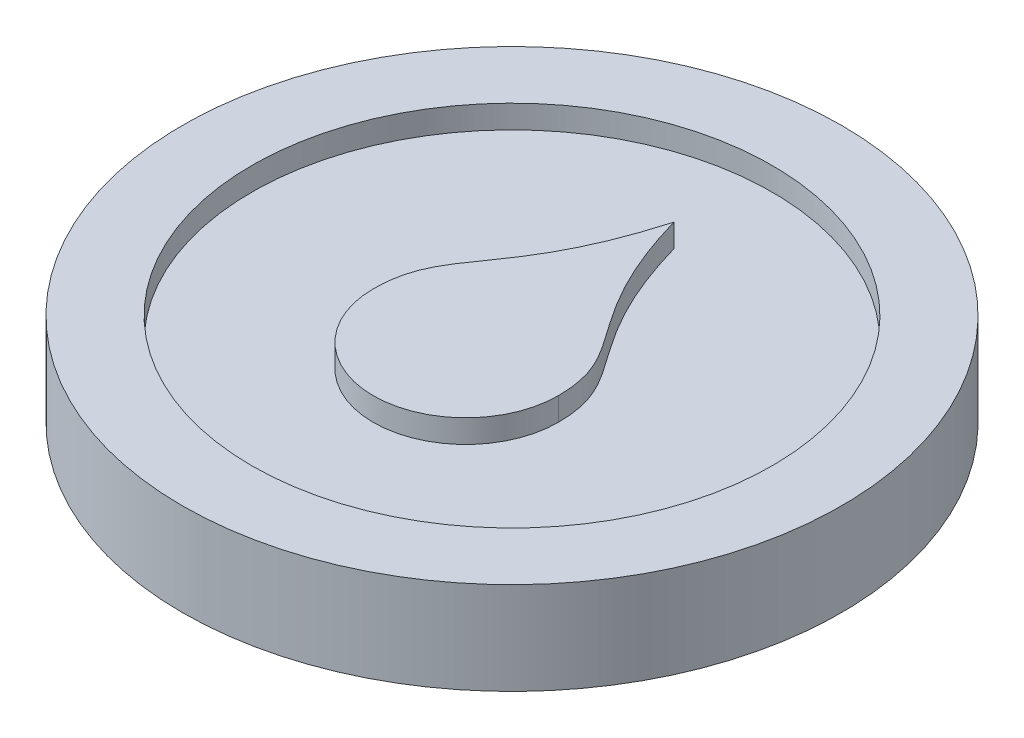
from build123d import *

# Parameters (mm, degrees)
SKETCH_1_R          = 14.25
EXTRUDE_1_DEPTH     = 4
SKETCH_2_R          = 11.25
CUT_EXTRUDE_1_DEPTH = 1
EXTRUDE_2_DEPTH     = 1


with BuildPart() as part:
    # 草图1 → 凸台-拉伸1 (new body)
    with BuildSketch(Plane(origin=(0, 0, 0), x_dir=(1, 0, 0), z_dir=(0, 1, 0))):
        with Locations(Location((0, 0, 0), (0, 0, 270))):
            Circle(SKETCH_1_R)
    extrude(amount=EXTRUDE_1_DEPTH)

    # 草图2 → 切除-拉伸1 (cut)
    with BuildSketch(Plane(origin=(0, 4, 0), x_dir=(1, 0, 0), z_dir=(0, 1, 0))):
        with Locations(Location((0, 0, 0), (0, 0, 270))):
            Circle(SKETCH_2_R)
    extrude(amount=-CUT_EXTRUDE_1_DEPTH, mode=Mode.SUBTRACT)

    # 草图3 → 凸台-拉伸2 (add)
    with BuildSketch(Plane(origin=(0, 3, 0), x_dir=(1, 0, 0), z_dir=(0, 1, 0))):
        with BuildLine():
            ThreePointArc((-4, -2), (0, -6), (4, -2))
            add(Edge.make_bspline(
                [(4, -2), (4, 1.17143168), (1.660537063, 1.196977672), (0, 7)],
                knots=[0, 0, 0, 0, 1, 1, 1, 1], degree=3))
            add(Edge.make_bspline(
                [(-4, -2), (-4, 1.17143168), (-1.660537063, 1.196977672), (0, 7)],
                knots=[0, 0, 0, 0, 1, 1, 1, 1], degree=3))
        make_face()
    extrude(amount=EXTRUDE_2_DEPTH)


solid = part.part
